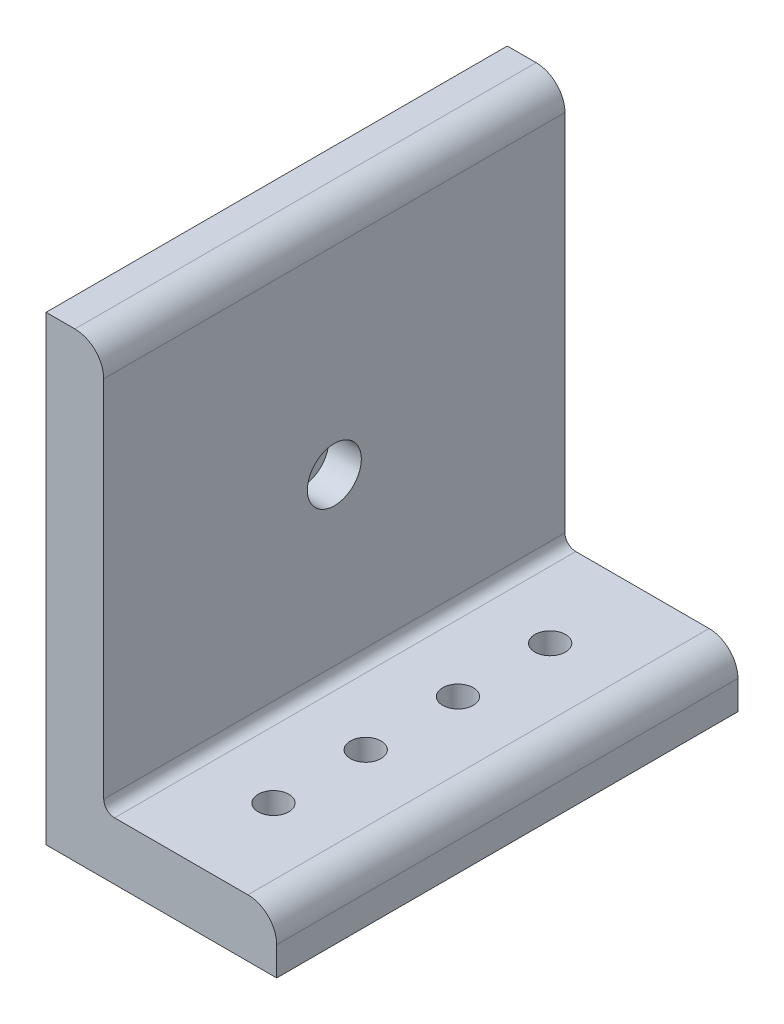
from build123d import *

# Parameters (mm, degrees)
L_ANGLE_L8X4X1_1_DEPTH                   = 203.2
F_1_2_CLEARANCE_HOLE1_D                  = 13.49248
CBORE_FOR_M12_HEX_HEAD_BOLT1_D           = 13.5
CBORE_FOR_M12_HEX_HEAD_BOLT1_CBORE_D     = 23.78
CBORE_FOR_M12_HEX_HEAD_BOLT1_CBORE_DEPTH = 14.3


with BuildPart() as part:
    # Sketch114 → L angle L8X4X1(1) (new body)
    with BuildSketch(Plane(origin=(390.937425431, -221.174980879, -133.663896304), x_dir=(1, 0, 0), z_dir=(0, 0, 1))):
        with BuildLine():
            Line((0, 0), (0, 203.2))
            Line((0, 203.2), (12.70508, 203.2))
            ThreePointArc((12.70508, 203.2), (21.681744019, 199.481744019), (25.4, 190.50508))
            Line((25.4, 190.50508), (25.4, 30.1625))
            ThreePointArc((25.4, 30.1625), (26.794903955, 26.794903955), (30.1625, 25.4))
            Line((30.1625, 25.4), (88.90508, 25.4))
            ThreePointArc((88.90508, 25.4), (97.881744019, 21.681744019), (101.6, 12.70508))
            Line((101.6, 12.70508), (101.6, 0))
            Line((101.6, 0), (0, 0))
        make_face()
    extrude(amount=L_ANGLE_L8X4X1_1_DEPTH)

    # 1/2 Clearance Hole1 (through all)
    with Locations(Plane(origin=(0, -195.774980879, 0), x_dir=(1, 0, 0), z_dir=(0, 1, 0))):
        with Locations((450.471215431, -28.896103696), (450.471215431, 93.023896304), (450.471215431, 52.383896304), (450.471215431, 11.743896304)):
            Hole(F_1_2_CLEARANCE_HOLE1_D / 2)

    # CBORE for M12 Hex Head Bolt1 (through all)
    with Locations(Plane(origin=(416.337425431, 0, 0), x_dir=(0, 0, -1), z_dir=(1, 0, 0))):
        with Locations((32.063896304, -118.000180879)):
            CounterBoreHole(CBORE_FOR_M12_HEX_HEAD_BOLT1_D / 2, CBORE_FOR_M12_HEX_HEAD_BOLT1_CBORE_D / 2, CBORE_FOR_M12_HEX_HEAD_BOLT1_CBORE_DEPTH)


solid = part.part
